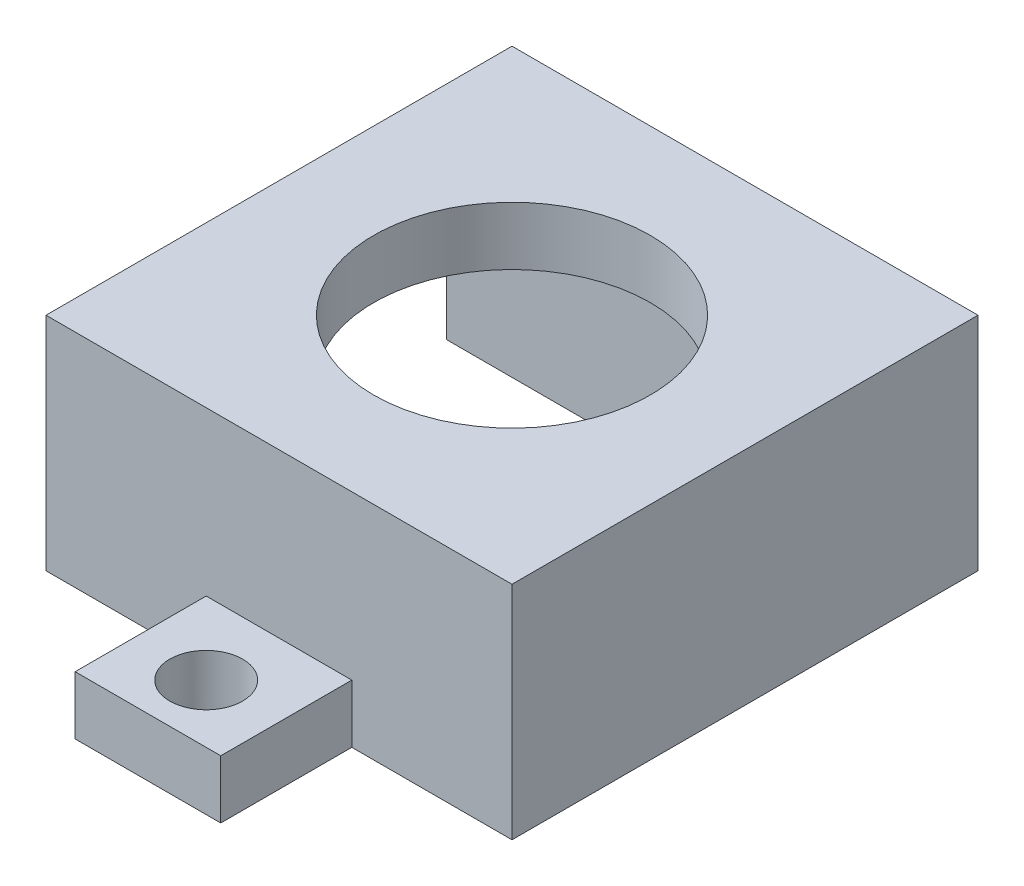
from build123d import *

# Parameters (mm, degrees)
SKETCH1_W           = 16
SKETCH1_H           = 16
BOSS_EXTRUDE1_DEPTH = 7.6
SKETCH2_W           = 11.5
SKETCH2_H           = 11.5
CUT_EXTRUDE1_DEPTH  = 5.6
SKETCH3_W           = 2.25
SKETCH3_H           = 11.5
CUT_EXTRUDE2_DEPTH  = 5.6
SKETCH4_R           = 4.75
CUT_EXTRUDE3_DEPTH  = 7.6
SKETCH5_W           = 5
SKETCH5_H           = 4.5
BOSS_EXTRUDE2_DEPTH = 2
CUT_EXTRUDE4_REACH  = 17.862
SKETCH6_R           = 1.25


with BuildPart() as part:
    # Sketch1 → Boss-Extrude1 (new body)
    with BuildSketch(Plane(origin=(0, 0, 0), x_dir=(1, 0, 0), z_dir=(0, 1, 0))):
        Rectangle(SKETCH1_W, SKETCH1_H)
    extrude(amount=BOSS_EXTRUDE1_DEPTH)

    # Sketch2 → Cut-Extrude1 (cut)
    with BuildSketch(Plane(origin=(0, 0, 0), x_dir=(1, 0, 0), z_dir=(0, 1, 0))):
        Rectangle(SKETCH2_W, SKETCH2_H)
    extrude(amount=CUT_EXTRUDE1_DEPTH, mode=Mode.SUBTRACT)

    # Sketch3 → Cut-Extrude2 (cut)
    with BuildSketch(Plane.XZ):
        with Locations((-6.875, 0)):
            Rectangle(SKETCH3_W, SKETCH3_H)
    extrude(amount=-CUT_EXTRUDE2_DEPTH, mode=Mode.SUBTRACT)

    # Sketch4 → Cut-Extrude3 (cut)
    with BuildSketch(Plane(origin=(0, 7.6, 0), x_dir=(1, 0, 0), z_dir=(0, 1, 0))):
        with Locations(Location((0, 0, 0), (0, 0, 270))):
            Circle(SKETCH4_R)
    extrude(amount=-CUT_EXTRUDE3_DEPTH, mode=Mode.SUBTRACT)

    # Sketch5 → Boss-Extrude2 (add)
    with BuildSketch(Plane(origin=(0, 0, 0), x_dir=(1, 0, 0), z_dir=(0, 1, 0))):
        with Locations((0, 10.25)):
            Rectangle(SKETCH5_W, SKETCH5_H)
    boss_extrude2 = extrude(amount=BOSS_EXTRUDE2_DEPTH)

    # Sketch6 → Cut-Extrude4 (cut, up to next)
    with BuildSketch(Plane(origin=(0, 2, 0), x_dir=(1, 0, 0), z_dir=(0, 1, 0)), mode=Mode.PRIVATE) as cut_extrude4_sk1:
        with Locations(Location((0, 10.5, 0), (0, 0, 270))):
            Circle(SKETCH6_R)
    cut_extrude4_tool1 = extrude(cut_extrude4_sk1.sketch, amount=-CUT_EXTRUDE4_REACH, mode=Mode.PRIVATE) & part.part
    cut_extrude4 = cut_extrude4_tool1.solids().sort_by_distance((0, 2, -10.5))[0]
    add(cut_extrude4, mode=Mode.SUBTRACT)

    # Mirror1: Boss-Extrude2, Cut-Extrude4 across plane
    add(boss_extrude2.mirror(Plane.XY))
    add(cut_extrude4.mirror(Plane.XY), mode=Mode.SUBTRACT)


solid = part.part
